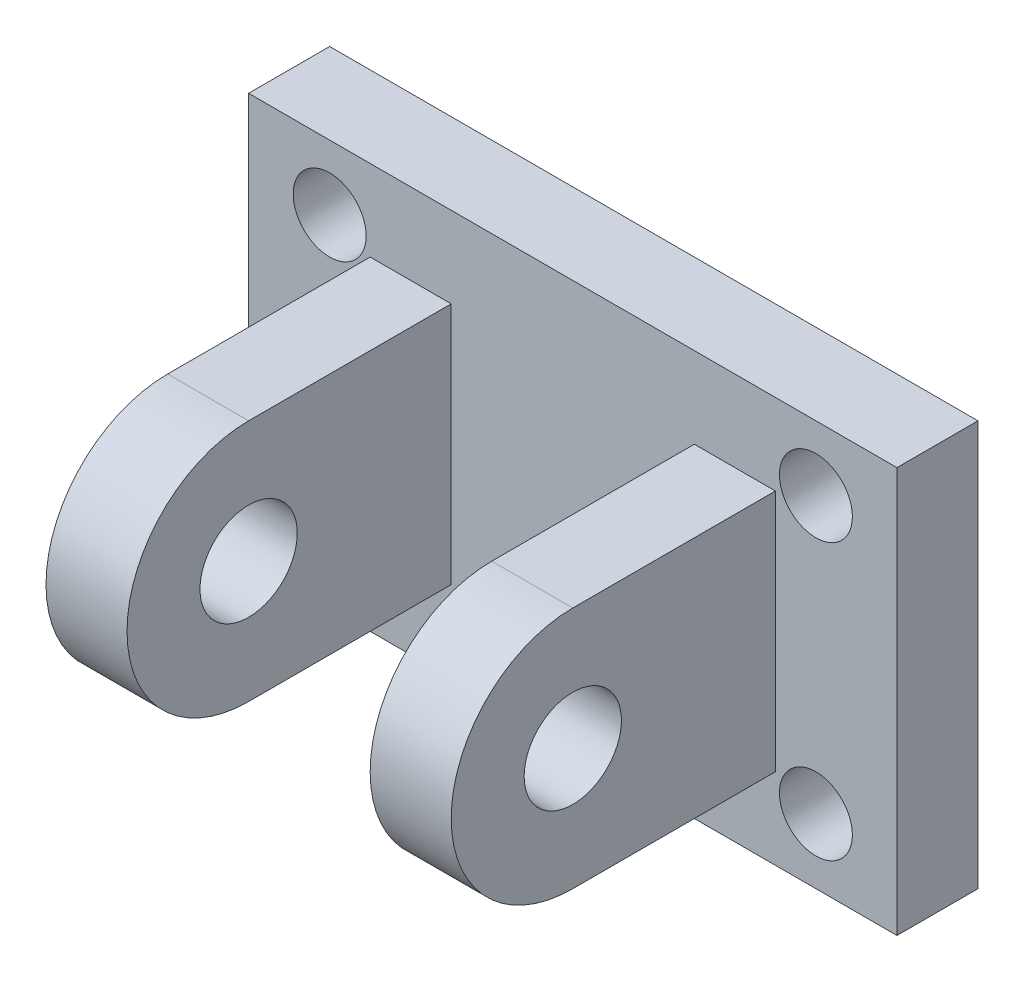
from build123d import *

# Parameters (mm, degrees)
SKETCH_1_W          = 80
SKETCH_1_H          = 50
EXTRUDE_1_DEPTH     = 10
EXTRUDE_2_DEPTH     = 10
SKETCH_3_R          = 6
CUT_EXTRUDE_1_DEPTH = 86.732140997
SKETCH_4_R          = 4.5
CUT_EXTRUDE_2_DEPTH = 69.738635424


with BuildPart() as part:
    # 草图1 → 凸台-拉伸1 (new body)
    with BuildSketch(Plane.XY):
        Rectangle(SKETCH_1_W, SKETCH_1_H)
    extrude(amount=EXTRUDE_1_DEPTH)

    # 草图2 → 凸台-拉伸2 (add)
    with BuildSketch(Plane(origin=(15, 0, 0), x_dir=(0, 0, -1), z_dir=(1, 0, 0))):
        with BuildLine():
            Line((-9.5, -15), (-35, -15))
            ThreePointArc((-35, -15), (-50, 0), (-35, 15))
            Line((-35, 15), (-9.5, 15))
            Line((-9.5, 15), (-9.5, -15))
        make_face()
    extrude_2 = extrude(amount=EXTRUDE_2_DEPTH)

    # 镜向1: 凸台-拉伸2 across plane
    add(extrude_2.mirror(Plane(origin=(0, 0, 0), x_dir=(0, 0, 1), z_dir=(1, 0, 0))))

    # 草图3 → 切除-拉伸1 (cut, through all)
    with BuildSketch(Plane(origin=(-25, 0, 0), x_dir=(0, 0, -1), z_dir=(1, 0, 0))):
        with Locations((-35, 0)):
            Circle(SKETCH_3_R)
    extrude(amount=CUT_EXTRUDE_1_DEPTH, mode=Mode.SUBTRACT)

    # 草图4 → 切除-拉伸2 (cut, through all)
    with BuildSketch(Plane.XY):
        with Locations((30, 17)):
            Circle(SKETCH_4_R)
        with Locations((30, -17)):
            Circle(SKETCH_4_R)
        with Locations((-30, 17)):
            Circle(SKETCH_4_R)
        with Locations((-30, -17)):
            Circle(SKETCH_4_R)
    extrude(amount=CUT_EXTRUDE_2_DEPTH, mode=Mode.SUBTRACT)


solid = part.part
